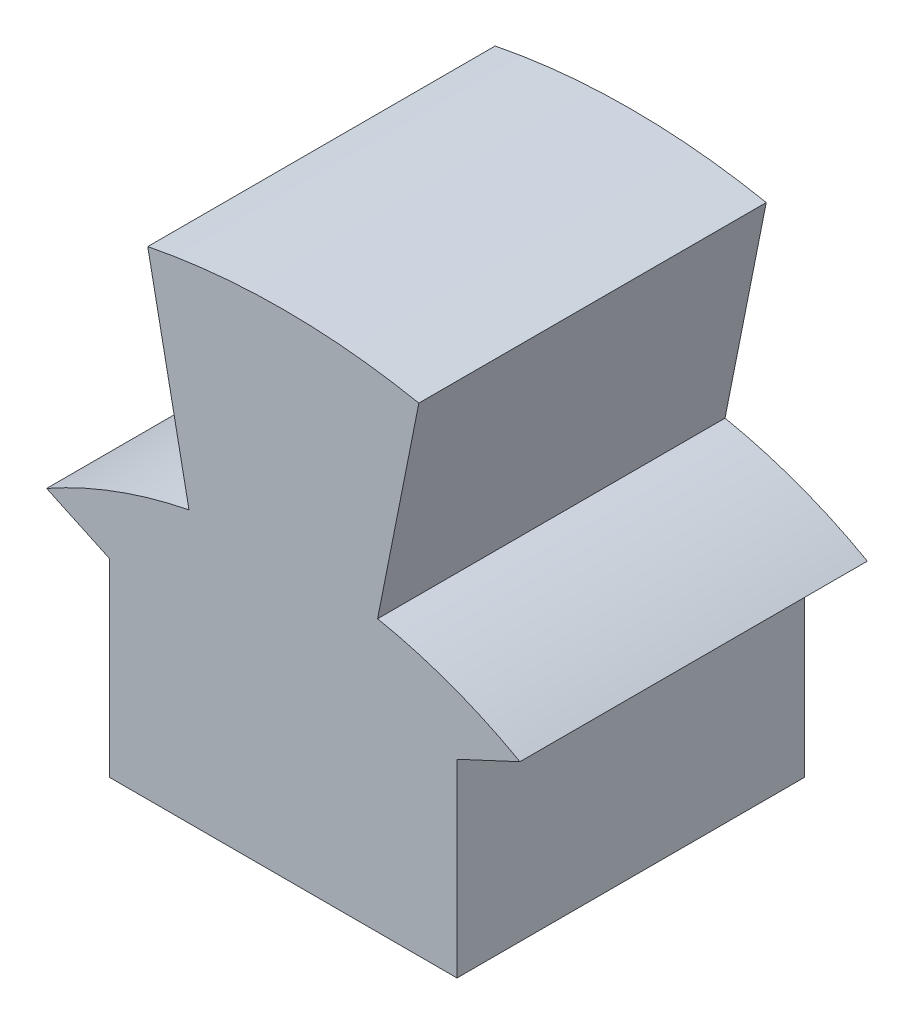
from build123d import *

# Parameters (mm, degrees)
RESSALTO_EXTRUS_O1_DEPTH = 6


with BuildPart() as part:
    # Esboço1 → Ressalto-extrusão1 (new body)
    with BuildSketch(Plane.XY):
        with BuildLine():
            Line((-3, -5.228144515), (-3, -8.5))
            Line((-3, -8.5), (3, -8.5))
            Line((3, -8.5), (3, -5.228144515))
            Line((3, -5.228144515), (4.087420479, -4.721072019))
            ThreePointArc((4.087420479, -4.721072019), (3.647489335, -4.490964091), (3.194657217, -4.28741522))
            ThreePointArc((3.194657217, -4.28741522), (2.423308565, -4.011422259), (1.628622126, -3.812363669))
            ThreePointArc((1.628622126, -3.812363669), (0, -3.65195839), (-1.628622126, -3.812363669))
            ThreePointArc((-1.628622126, -3.812363669), (-2.423308565, -4.011422259), (-3.194657217, -4.28741522))
            ThreePointArc((-3.194657217, -4.28741522), (-3.647489335, -4.490964091), (-4.087420479, -4.721072019))
            Line((-4.087420479, -4.721072019), (-3, -5.228144515))
        make_face()
        with BuildLine():
            Line((-2.341083864, -0.230576635), (-1.628622126, -3.812363669))
            ThreePointArc((-1.628622126, -3.812363669), (0, -3.65195839), (1.628622126, -3.812363669))
            Line((1.628622126, -3.812363669), (2.341083864, -0.230576635))
            ThreePointArc((2.341083864, -0.230576635), (1.176205684, -0.05778328), (0, 0))
            ThreePointArc((0, 0), (-1.176205684, -0.05778328), (-2.341083864, -0.230576635))
        make_face()
    extrude(amount=RESSALTO_EXTRUS_O1_DEPTH)


solid = part.part
